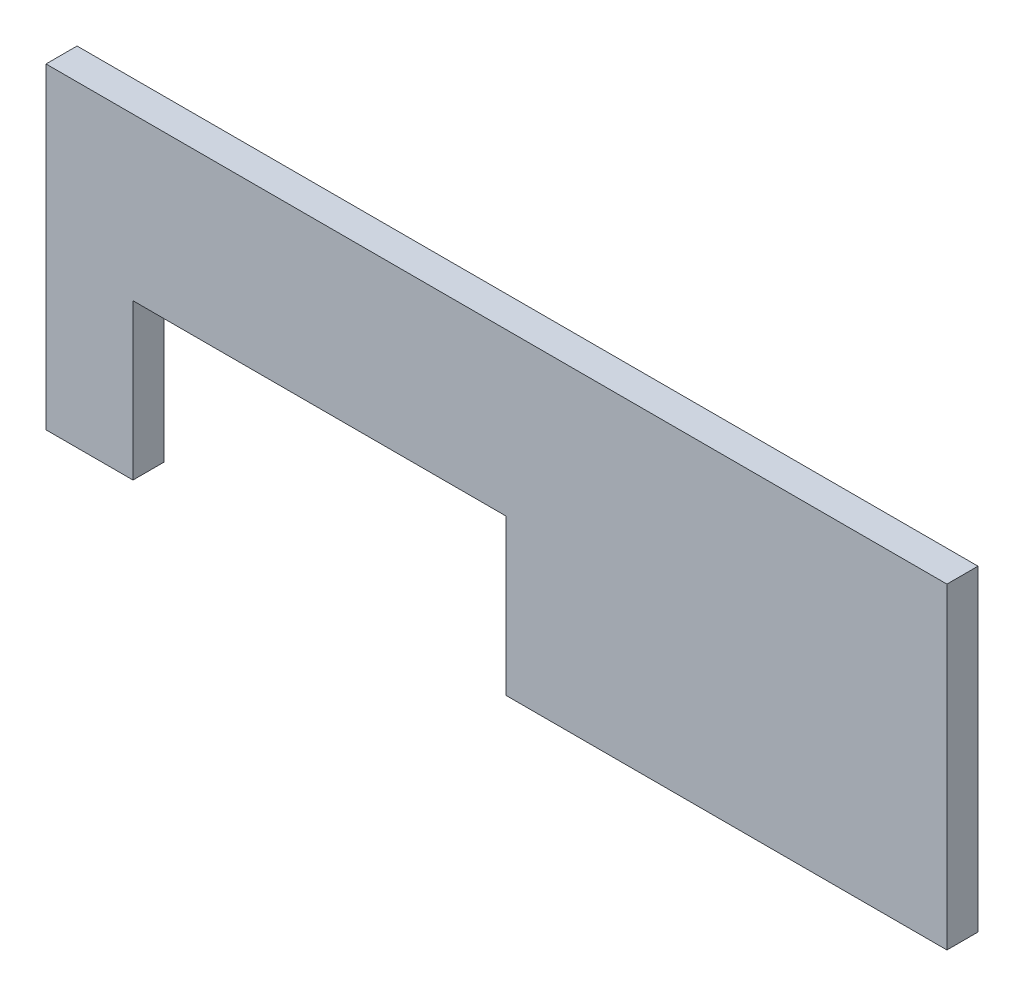
from build123d import *

# Parameters (mm, degrees)
EXTRUSION1_DEPTH = 5


with BuildPart() as part:
    # Esquisse1 → Extrusion1 (new body)
    with BuildSketch(Plane.XY):
        Polygon((-48.749448329, -48.162307692), (-34.749448329, -48.162307692), (-34.749448329, -23.162307692), (25.250551671, -23.162307692), (25.250551671, -48.162307692), (96.250551671, -48.162307692), (96.250551671, 2.837692308), (-48.749448329, 2.837692308), align=None)
    extrude(amount=EXTRUSION1_DEPTH)


solid = part.part
